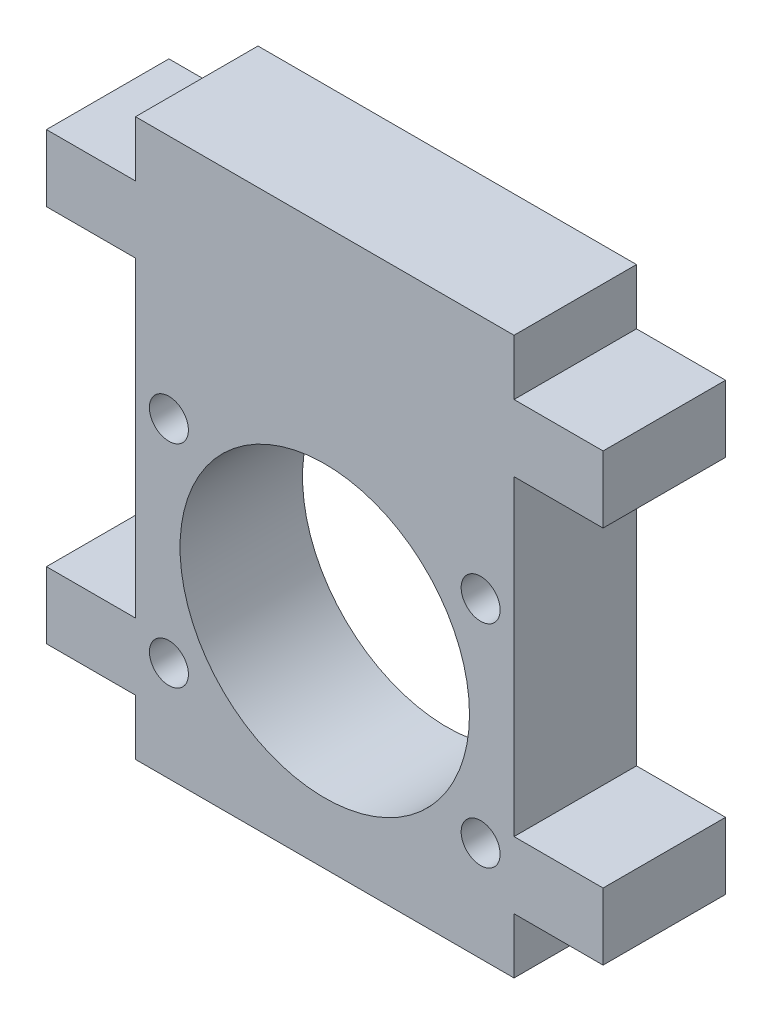
from build123d import *

# Parameters (mm, degrees)
ESQUISSE1_R        = 13
ESQUISSE1_R_2      = 1.75
BOSS_EXTRU_1_DEPTH = 11


with BuildPart() as part:
    # Esquisse1 → Boss.-Extru.1 (new body)
    with BuildSketch(Plane.XY):
        Polygon((0, 25), (0, 6), (-8, 6), (-8, 0), (0, 0), (0, -5), (34, -5), (34, 0), (42, 0), (42, 6), (34, 6), (34, 25), (34, 34), (42, 34), (42, 40), (34, 40), (34, 45), (0, 45), (0, 40), (-8, 40), (-8, 34), (0, 34), align=None)
        with Locations((17, 13.5)):
            Circle(ESQUISSE1_R, mode=Mode.SUBTRACT)
        with Locations((3, 23)):
            Circle(ESQUISSE1_R_2, mode=Mode.SUBTRACT)
        with Locations((31, 23)):
            Circle(ESQUISSE1_R_2, mode=Mode.SUBTRACT)
        with Locations((31, 4)):
            Circle(ESQUISSE1_R_2, mode=Mode.SUBTRACT)
        with Locations((3, 4)):
            Circle(ESQUISSE1_R_2, mode=Mode.SUBTRACT)
    extrude(amount=BOSS_EXTRU_1_DEPTH)


solid = part.part
